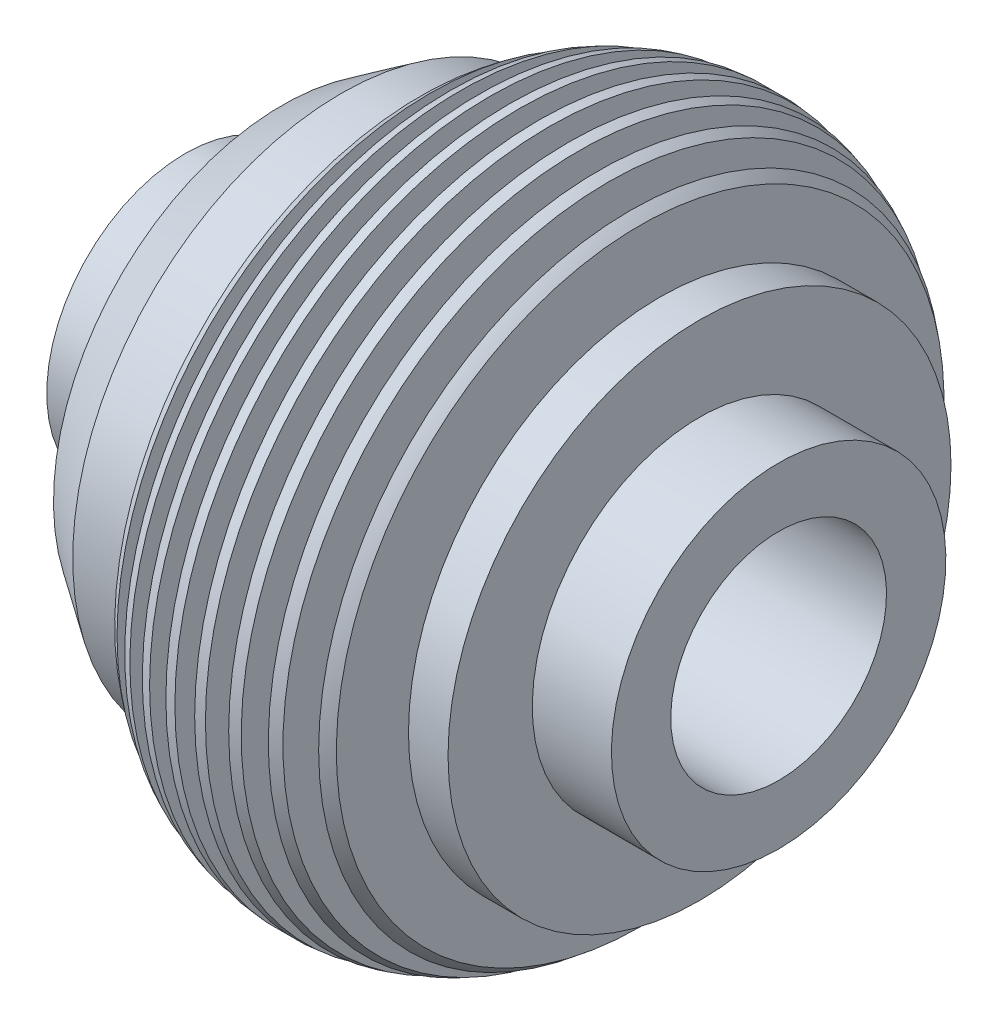
from build123d import *


with BuildPart() as part:
    # Sketch1 → Revolve1 (revolve)
    with BuildSketch(Plane.XY, mode=Mode.PRIVATE) as revolve1_sk:
        with BuildLine():
            Line((-40, 20), (-50, 20))
            Line((-50, 20), (-50, 0))
            Line((-50, 0), (0, 0))
            Line((0, 0), (0, 12.26993865))
            Line((0, 12.26993865), (29.439071242, 12.26993865))
            Line((29.439071242, 12.26993865), (29.439071242, 28.82661238))
            Line((29.439071242, 28.82661238), (26.939071242, 28.82661238))
            Line((26.939071242, 28.82661238), (26.939071242, 70.956055766))
            ThreePointArc((26.939071242, 70.956055766), (25.684040418, 70.638264837), (24.439071242, 70.283095588))
            Line((24.439071242, 70.283095588), (24.439071242, 28.82661238))
            Line((24.439071242, 28.82661238), (19.439071242, 28.82661238))
            Line((19.439071242, 28.82661238), (19.439071242, 68.432672522))
            ThreePointArc((19.439071242, 68.432672522), (18.179445476, 67.85181502), (16.939071242, 67.230909015))
            Line((16.939071242, 67.230909015), (16.939071242, 28.82661238))
            Line((16.939071242, 28.82661238), (11.939071242, 28.82661238))
            Line((11.939071242, 28.82661238), (11.939071242, 64.18039577))
            ThreePointArc((11.939071242, 64.18039577), (10.671746733, 63.249245387), (9.439071242, 62.272688383))
            Line((9.439071242, 62.272688383), (9.439071242, 28.82661238))
            Line((9.439071242, 28.82661238), (4.439071242, 28.82661238))
            Line((4.439071242, 28.82661238), (4.439071242, 52.883509313))
            Line((4.439071242, 52.883509313), (-10.560928758, 52.883509313))
            Line((-10.560928758, 52.883509313), (-25.483605064, 42.81803705))
            Line((-25.483605064, 42.81803705), (-25.483605064, 26.193767786))
            Line((-25.483605064, 26.193767786), (-25.483605064, 21.51803705))
            Line((-25.483605064, 21.51803705), (-25.483605064, 21.193767786))
            Line((-25.483605064, 21.193767786), (-25.483605064, 20))
            ThreePointArc((-25.483605064, 20), (-28.412537252, 12.928932188), (-35.483605064, 10))
            Line((-35.483605064, 10), (-40, 10))
            Line((-40, 10), (-40, 20))
        make_face()
        with BuildLine():
            Line((29.439071242, 28.82661238), (29.439071242, 12.26993865))
            Line((29.439071242, 12.26993865), (44.439071242, 12.26993865))
            Line((44.439071242, 12.26993865), (44.439071242, 28.82661238))
            Line((44.439071242, 28.82661238), (41.939071242, 28.82661238))
            Line((41.939071242, 28.82661238), (41.939071242, 71.836959972))
            ThreePointArc((41.939071242, 71.836959972), (40.690646644, 71.963785236), (39.439071242, 72.054381233))
            Line((39.439071242, 72.054381233), (39.439071242, 28.82661238))
            Line((39.439071242, 28.82661238), (34.439071242, 28.82661238))
            Line((34.439071242, 28.82661238), (34.439071242, 72.054381233))
            ThreePointArc((34.439071242, 72.054381233), (33.187495839, 71.963785236), (31.939071242, 71.836959972))
            Line((31.939071242, 71.836959972), (31.939071242, 28.82661238))
            Line((31.939071242, 28.82661238), (29.439071242, 28.82661238))
        make_face()
        with BuildLine():
            Line((44.439071242, 28.82661238), (44.439071242, 12.26993865))
            Line((44.439071242, 12.26993865), (100, 12.26993865))
            Line((100, 12.26993865), (100, 27.26993865))
            Line((100, 27.26993865), (80, 27.26993865))
            Line((80, 27.26993865), (80, 48.56993865))
            Line((80, 48.56993865), (70, 48.56993865))
            Line((70, 48.56993865), (70, 28.82661238))
            Line((70, 28.82661238), (65, 28.82661238))
            Line((65, 28.82661238), (65, 61.803487266))
            ThreePointArc((65, 61.803487266), (63.768152096, 62.813233579), (62.5, 63.776990361))
            Line((62.5, 63.776990361), (62.5, 28.82661238))
            Line((62.5, 28.82661238), (56.939071242, 28.82661238))
            Line((56.939071242, 28.82661238), (56.939071242, 67.230909015))
            ThreePointArc((56.939071242, 67.230909015), (55.698697008, 67.85181502), (54.439071242, 68.432672522))
            Line((54.439071242, 68.432672522), (54.439071242, 28.82661238))
            Line((54.439071242, 28.82661238), (49.439071242, 28.82661238))
            Line((49.439071242, 28.82661238), (49.439071242, 70.283095588))
            ThreePointArc((49.439071242, 70.283095588), (48.194102066, 70.638264837), (46.939071242, 70.956055766))
            Line((46.939071242, 70.956055766), (46.939071242, 28.82661238))
            Line((46.939071242, 28.82661238), (44.439071242, 28.82661238))
        make_face()
    revolve(revolve1_sk.sketch.rotate(Axis((-50, -15, 0), (1, 0, 0)), 180), axis=Axis((-50, -15, 0), (1, 0, 0)))


solid = part.part
